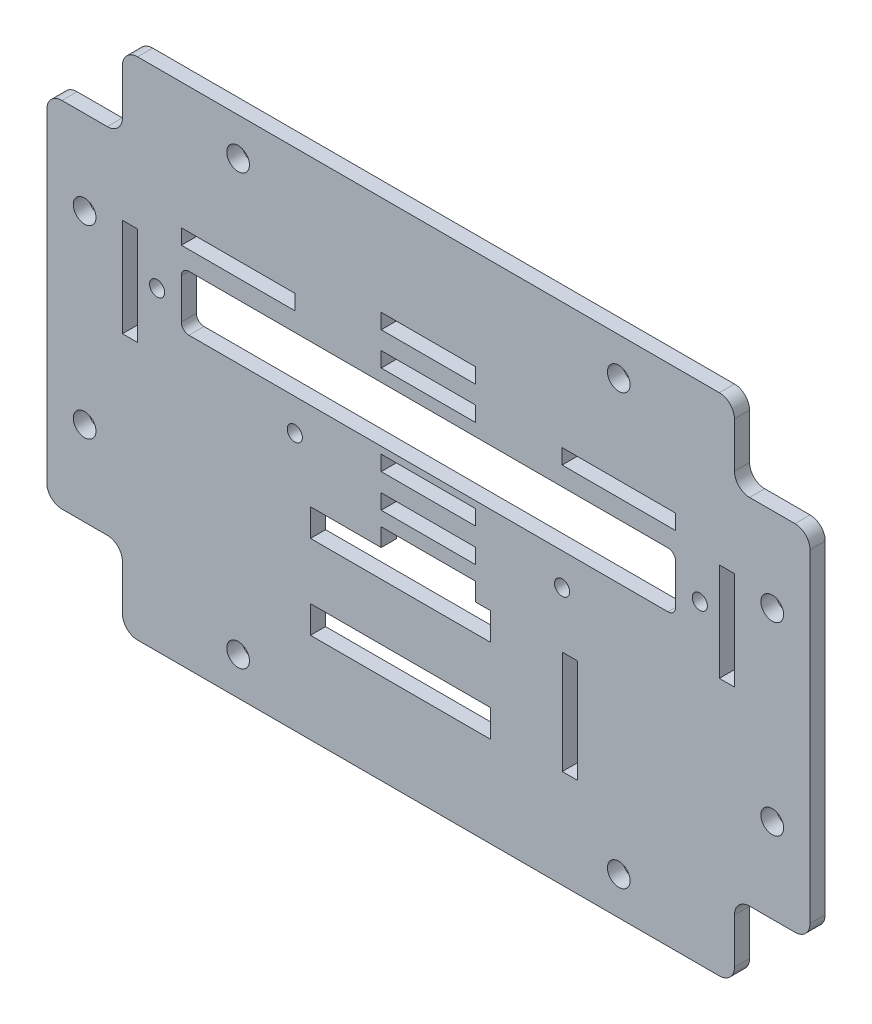
from build123d import *

# Parameters (mm, degrees)
SKETCH1_R           = 3.81
SKETCH1_W           = 5.08
SKETCH1_H           = 34.754656801
SKETCH1_W_2         = 31.75
SKETCH1_H_2         = 5.08
SKETCH1_R_2         = 2.54
SKETCH1_W_3         = 38.1
BOSS_EXTRUDE1_DEPTH = 5.08


with BuildPart() as part:
    # Sketch1 → Boss-Extrude1 (new body)
    with BuildSketch(Plane.XY):
        with BuildLine():
            ThreePointArc((51.011314264, 16.355277108), (54.603416713, 17.84317466), (56.091314264, 21.435277108))
            Line((56.091314264, 21.435277108), (56.091314264, 36.675277108))
            ThreePointArc((56.091314264, 36.675277108), (57.579211816, 40.267379557), (61.171314264, 41.755277108))
            Line((61.171314264, 41.755277108), (76.411314264, 41.755277108))
            ThreePointArc((76.411314264, 41.755277108), (80.003416713, 43.24317466), (81.491314264, 46.835277108))
            Line((81.491314264, 46.835277108), (81.491314264, 155.588877174))
            ThreePointArc((81.491314264, 155.588877174), (80.003416713, 159.180979622), (76.411314264, 160.668877174))
            Line((76.411314264, 160.668877174), (61.171314264, 160.668877174))
            ThreePointArc((61.171314264, 160.668877174), (57.579211816, 162.156774726), (56.091314264, 165.748877174))
            Line((56.091314264, 165.748877174), (56.091314264, 180.988877174))
            ThreePointArc((56.091314264, 180.988877174), (54.603416713, 184.580979622), (51.011314264, 186.068877174))
            Line((51.011314264, 186.068877174), (-144.469703574, 186.068877174))
            ThreePointArc((-144.469703574, 186.068877174), (-148.061806022, 184.580979622), (-149.549703574, 180.988877174))
            Line((-149.549703574, 180.988877174), (-149.549703574, 165.748877174))
            ThreePointArc((-149.549703574, 165.748877174), (-151.037601126, 162.156774726), (-154.629703574, 160.668877174))
            Line((-154.629703574, 160.668877174), (-169.869703574, 160.668877174))
            ThreePointArc((-169.869703574, 160.668877174), (-173.461806022, 159.180979622), (-174.949703574, 155.588877174))
            Line((-174.949703574, 155.588877174), (-174.949703574, 46.835277108))
            ThreePointArc((-174.949703574, 46.835277108), (-173.461806022, 43.24317466), (-169.869703574, 41.755277108))
            Line((-169.869703574, 41.755277108), (-154.629703574, 41.755277108))
            ThreePointArc((-154.629703574, 41.755277108), (-151.037601126, 40.267379557), (-149.549703574, 36.675277108))
            Line((-149.549703574, 36.675277108), (-149.549703574, 21.435277108))
            ThreePointArc((-149.549703574, 21.435277108), (-148.061806022, 17.84317466), (-144.469703574, 16.355277108))
            Line((-144.469703574, 16.355277108), (51.011314264, 16.355277108))
        make_face()
        with Locations((-110.682245407, 29.055277108)):
            Circle(SKETCH1_R, mode=Mode.SUBTRACT)
        Polygon((-25.922239135, 55.997635261), (-25.922239135, 49.700309173), (-25.922239135, 46.781251801), (-86.372159657, 46.781251801), (-86.372159657, 55.997635261), align=None, mode=Mode.SUBTRACT)
        with Locations((-162.249703574, 70.149378101)):
            Circle(SKETCH1_R, mode=Mode.SUBTRACT)
        Polygon((-25.922239135, 84.197043075), (-25.922239135, 77.899716987), (-25.922239135, 74.980659615), (-86.372159657, 74.980659615), (-86.372159657, 84.197043075), (-62.604194655, 84.197043075), (-62.604194655, 90.255887093), (-30.854194655, 90.255887093), (-30.854194655, 84.197043075), align=None, mode=Mode.SUBTRACT)
        with Locations((17.223856098, 29.055277108)):
            Circle(SKETCH1_R, mode=Mode.SUBTRACT)
        with Locations((0.772267685, 66.819714675)):
            Rectangle(SKETCH1_W, SKETCH1_H, mode=Mode.SUBTRACT)
        with Locations((-46.729194655, 97.608815198)):
            Rectangle(SKETCH1_W_2, SKETCH1_H_2, mode=Mode.SUBTRACT)
        with Locations((68.791314264, 70.149378101)):
            Circle(SKETCH1_R, mode=Mode.SUBTRACT)
        Polygon((-149.549703574, 135.965208253), (-144.469703574, 135.965208253), (-144.469703574, 127.195635913), (-144.469703574, 102.945208253), (-149.549703574, 102.945208253), align=None, mode=Mode.SUBTRACT)
        with Locations((-137.903692136, 121.995208253)):
            Circle(SKETCH1_R_2, mode=Mode.SUBTRACT)
        with Locations((-162.249703574, 132.274776181)):
            Circle(SKETCH1_R, mode=Mode.SUBTRACT)
        with Locations((-91.632245407, 102.945208253)):
            Circle(SKETCH1_R_2, mode=Mode.SUBTRACT)
        with Locations((-110.682245407, 141.140921067)):
            Rectangle(SKETCH1_W_3, SKETCH1_H_2, mode=Mode.SUBTRACT)
        with Locations((-110.682245407, 173.368877174)):
            Circle(SKETCH1_R, mode=Mode.SUBTRACT)
        with Locations((-46.729194655, 108.841683137)):
            Rectangle(SKETCH1_W_2, SKETCH1_H_2, mode=Mode.SUBTRACT)
        with Locations((-1.826143902, 102.945208253)):
            Circle(SKETCH1_R_2, mode=Mode.SUBTRACT)
        with BuildLine():
            ThreePointArc((33.767746549, 132.274776181), (35.563797773, 131.530827406), (36.307746549, 129.734776181))
            Line((36.307746549, 129.734776181), (36.307746549, 127.195635913))
            Line((36.307746549, 127.195635913), (36.307746549, 116.226694176))
            ThreePointArc((36.307746549, 116.226694176), (35.563797773, 114.430642952), (33.767746549, 113.686694176))
            Line((33.767746549, 113.686694176), (-127.226135859, 113.686694176))
            ThreePointArc((-127.226135859, 113.686694176), (-129.022187083, 114.430642952), (-129.766135859, 116.226694176))
            Line((-129.766135859, 116.226694176), (-129.766135859, 127.195635913))
            Line((-129.766135859, 127.195635913), (-129.766135859, 129.734776181))
            ThreePointArc((-129.766135859, 129.734776181), (-129.022187083, 131.530827406), (-127.226135859, 132.274776181))
            Line((-127.226135859, 132.274776181), (33.767746549, 132.274776181))
        make_face(mode=Mode.SUBTRACT)
        with Locations((-46.729194655, 138.978682913)):
            Rectangle(SKETCH1_W_2, SKETCH1_H_2, mode=Mode.SUBTRACT)
        with Locations((17.223856098, 141.140921067)):
            Rectangle(SKETCH1_W_3, SKETCH1_H_2, mode=Mode.SUBTRACT)
        with Locations((44.445302826, 121.995208253)):
            Circle(SKETCH1_R_2, mode=Mode.SUBTRACT)
        Polygon((51.011314264, 127.195635913), (51.011314264, 135.965208253), (56.091314264, 135.965208253), (56.091314264, 102.945208253), (51.011314264, 102.945208253), align=None, mode=Mode.SUBTRACT)
        with Locations((68.791314264, 132.274776181)):
            Circle(SKETCH1_R, mode=Mode.SUBTRACT)
        with Locations((-46.729194655, 150.112295085)):
            Rectangle(SKETCH1_W_2, SKETCH1_H_2, mode=Mode.SUBTRACT)
        with Locations((17.223856098, 173.368877174)):
            Circle(SKETCH1_R, mode=Mode.SUBTRACT)
    extrude(amount=BOSS_EXTRUDE1_DEPTH)


solid = part.part
